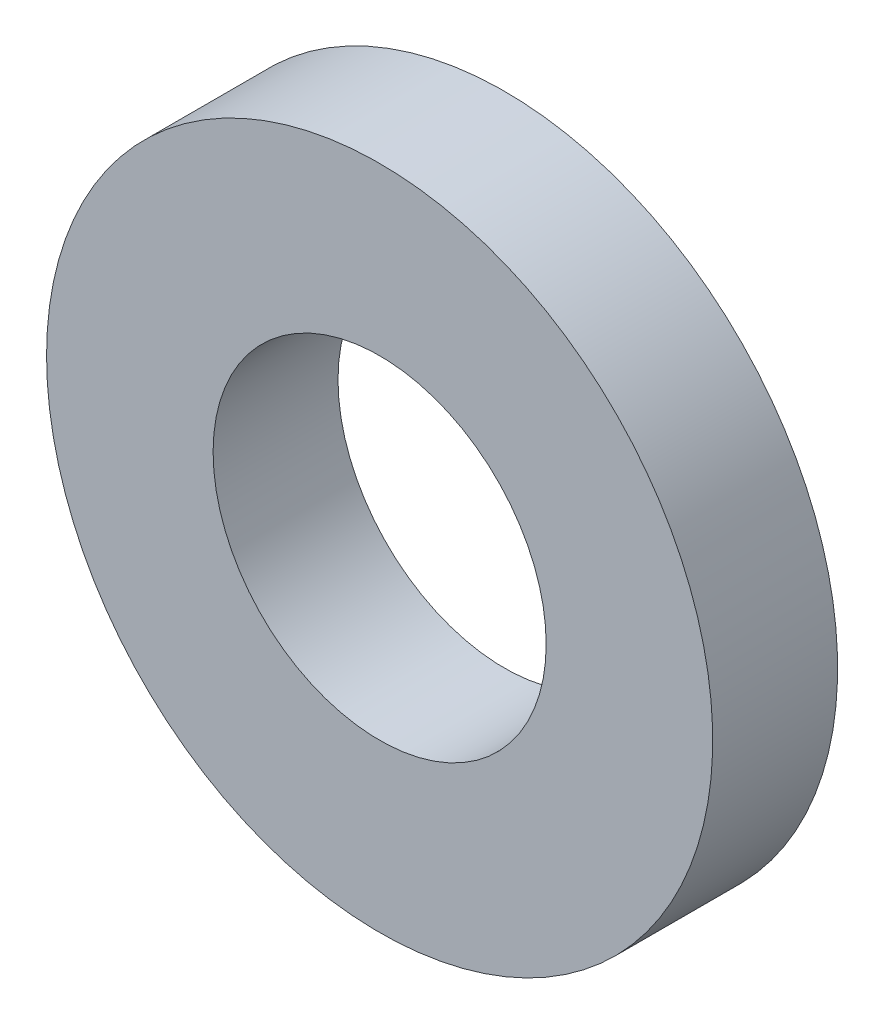
from build123d import *

# Parameters (mm, degrees)
SKETCH1_R           = 12.7
SKETCH1_R_2         = 6.35
BOSS_EXTRUDE1_DEPTH = 2.38125


with BuildPart() as part:
    # Sketch1 → Boss-Extrude1 (new, symmetric)
    with BuildSketch(Plane.XY):
        with Locations(Location((0, 0, 0), (0, 0, 180))):
            Circle(SKETCH1_R)
        with Locations(Location((0, 0, 0), (0, 0, 180))):
            Circle(SKETCH1_R_2, mode=Mode.SUBTRACT)
    extrude(amount=BOSS_EXTRUDE1_DEPTH, both=True)


solid = part.part
